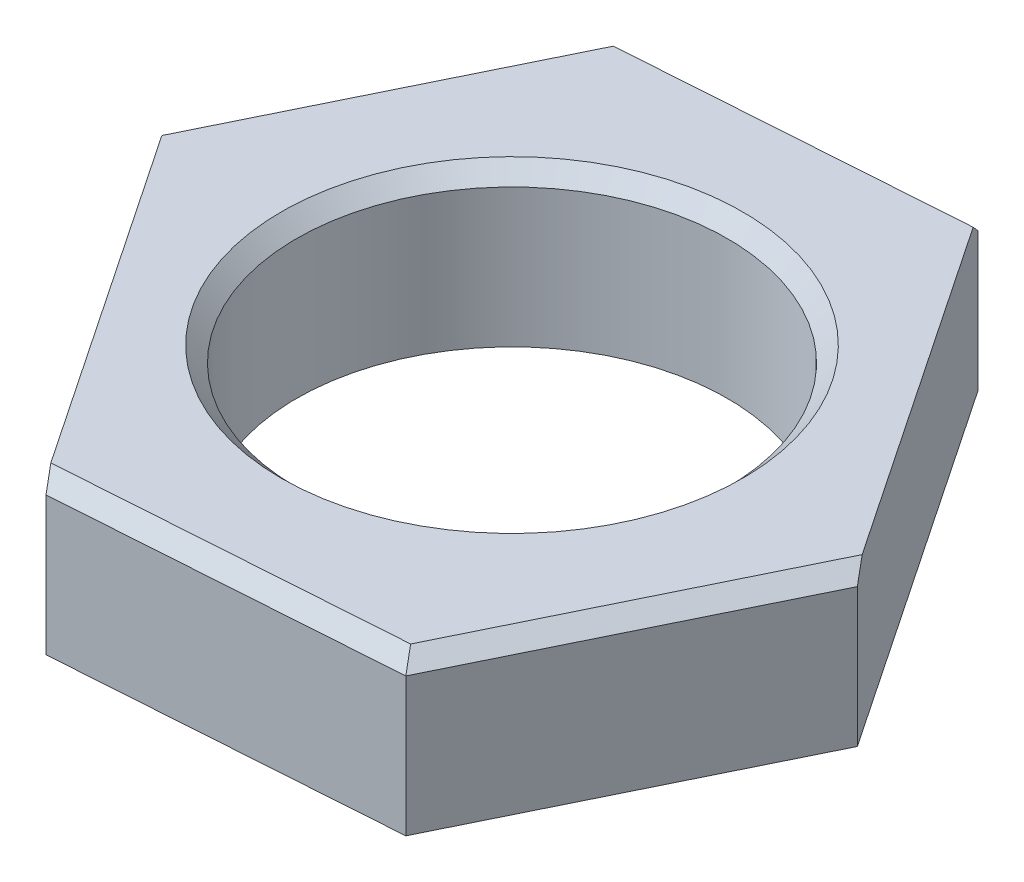
from build123d import *

# Parameters (mm, degrees)
SKETCH1_R           = 7
BOSS_EXTRUDE1_DEPTH = 5
CHAMFER1_SIZE       = 0.5
CUT_EXTRUDE1_DEPTH  = 18.76901793


with BuildPart() as part:
    # Sketch1 → Boss-Extrude1 (new body)
    with BuildSketch(Plane(origin=(0, 0, 0), x_dir=(1, 0, 0), z_dir=(0, 1, 0))):
        Polygon((7.08862867, -10.539671575), (12.671937667, 0.869096719), (5.583308997, 11.408768294), (-7.08862867, 10.539671575), (-12.671937667, -0.869096719), (-5.583308997, -11.408768294), align=None)
        with Locations(Location((0, 0, 0), (0, 0, 270))):
            Circle(SKETCH1_R, mode=Mode.SUBTRACT)
    extrude(amount=BOSS_EXTRUDE1_DEPTH)

    # Chamfer1
    chamfer1_edges = [part.edges().sort_by_distance(p)[0] for p in [
        (9.127623332, 5, -6.138932506),
        (-0.752659837, 5, -10.974219934),
        (-9.880283168, 5, -4.835287428),
        (0, 5, -7),
        (-9.127623332, 5, 6.138932506),
        (0.752659837, 5, 10.974219934),
        (9.880283168, 5, 4.835287428),
    ]]
    chamfer(chamfer1_edges, length=CHAMFER1_SIZE)

    # Sketch2 → Cut-Extrude1 (cut, through all)
    with BuildSketch(Plane(origin=(0, 5, 0), x_dir=(1, 0, 0), z_dir=(0, 1, 0))):
        Polygon((-12.369841003, 1.369496951), (-3.313446114, -12.095932292), (-6.221668225, -14.051904686), (-15.278063114, -0.586475443), align=None)
        Polygon((3.396053842, 11.973107643), (6.304275954, 13.929080037), (15.360670843, 0.463650794), (12.452448732, -1.4923216), align=None)
    extrude(amount=-CUT_EXTRUDE1_DEPTH, mode=Mode.SUBTRACT)


solid = part.part
